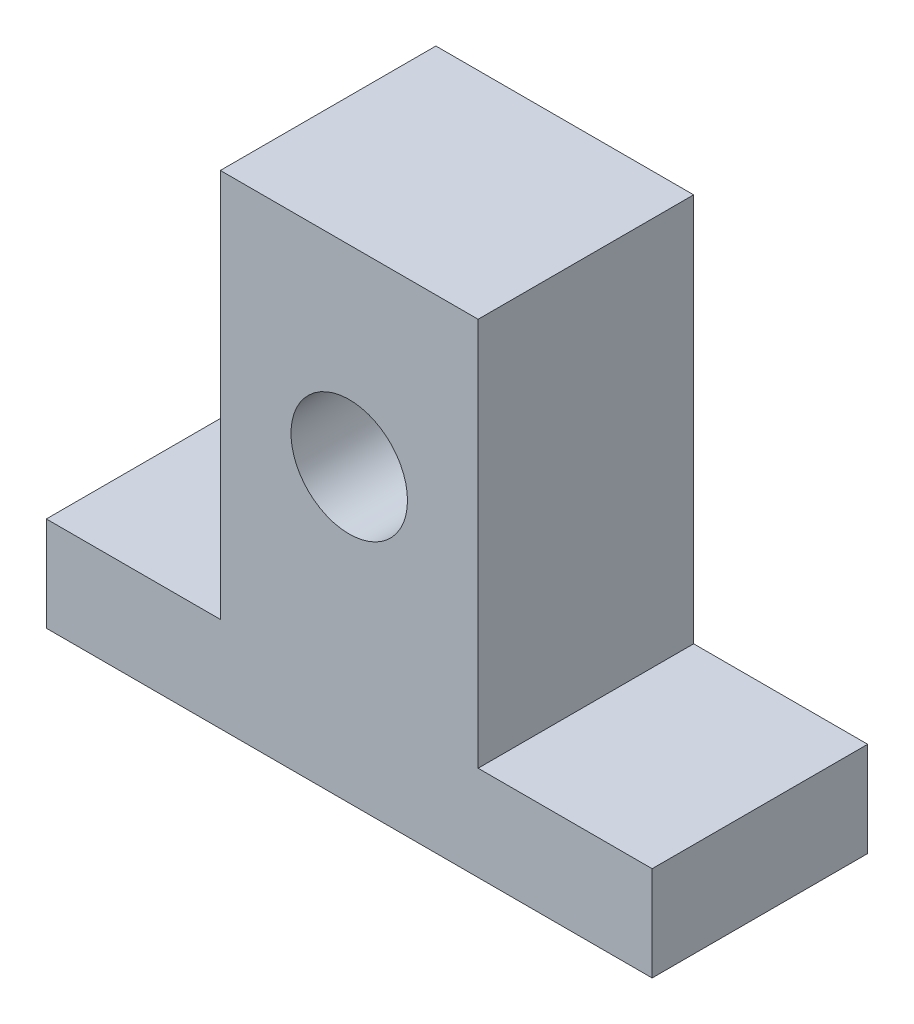
from build123d import *

# Parameters (mm, degrees)
SKETCH1_R           = 4
BOSS_EXTRUDE1_DEPTH = 14.8


with BuildPart() as part:
    # Sketch1 → Boss-Extrude1 (new body)
    with BuildSketch(Plane.XY):
        Polygon((-20.8, 0), (20.8, 0), (20.8, 6.5), (8.85, 6.5), (8.85, 33.2), (-8.85, 33.2), (-8.85, 6.5), (-20.8, 6.5), align=None)
        with Locations((0, 20)):
            Circle(SKETCH1_R, mode=Mode.SUBTRACT)
    extrude(amount=BOSS_EXTRUDE1_DEPTH)


solid = part.part
